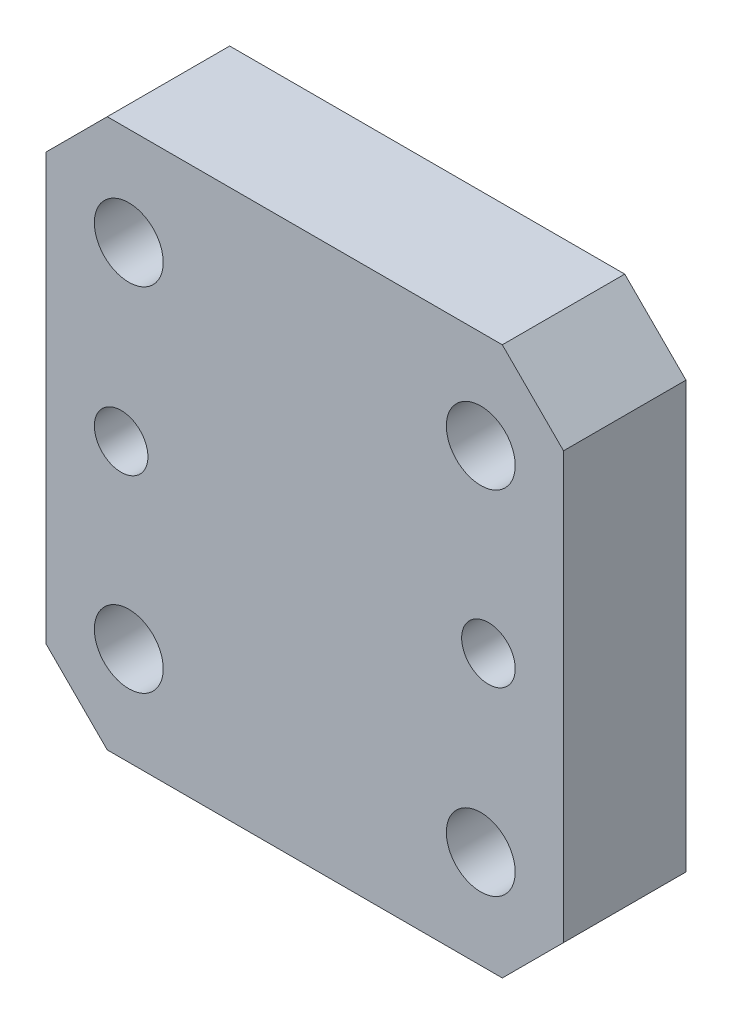
from build123d import *

# Parameters (mm, degrees)
SKETCH1_W           = 33.814565048
SKETCH1_H           = 35.83261461
BOSS_EXTRUDE1_DEPTH = 8
SKETCH2_R           = 1.75
CUT_EXTRUDE1_DEPTH  = 8
SKETCH3_R           = 2.25
CUT_EXTRUDE2_DEPTH  = 10
CHAMFER1_SIZE       = 4
CUT_EXTRUDE3_DEPTH  = 3


with BuildPart() as part:
    # Sketch1 → Boss-Extrude1 (new body)
    with BuildSketch(Plane.XY):
        Rectangle(SKETCH1_W, SKETCH1_H)
    extrude(amount=BOSS_EXTRUDE1_DEPTH)

    # Sketch2 → Cut-Extrude1 (cut)
    with BuildSketch(Plane.XY.offset(8)):
        with Locations((-12, 0)):
            Circle(SKETCH2_R)
        with Locations((12, 0)):
            Circle(SKETCH2_R)
    extrude(amount=-CUT_EXTRUDE1_DEPTH, mode=Mode.SUBTRACT)

    # Sketch3 → Cut-Extrude2 (cut)
    with BuildSketch(Plane(origin=(0, 0, 0), x_dir=(-1, 0, 0), z_dir=(0, 0, -1))):
        with Locations((11.5, -11.5)):
            Circle(SKETCH3_R)
        with Locations((-11.5, -11.5)):
            Circle(SKETCH3_R)
        with Locations((-11.5, 11.5)):
            Circle(SKETCH3_R)
        with Locations((11.5, 11.5)):
            Circle(SKETCH3_R)
    extrude(amount=-CUT_EXTRUDE2_DEPTH, mode=Mode.SUBTRACT)

    # Chamfer1
    chamfer1_edges = [part.edges().sort_by_distance(p)[0] for p in [
        (-16.907282524, 17.916307305, 4),
        (16.907282524, 17.916307305, 4),
        (16.907282524, -17.916307305, 4),
        (-16.907282524, -17.916307305, 4),
    ]]
    chamfer(chamfer1_edges, length=CHAMFER1_SIZE)

    # Sketch4 → Cut-Extrude3 (cut)
    with BuildSketch(Plane(origin=(0, 0, 0), x_dir=(-1, 0, 0), z_dir=(0, 0, -1))):
        Polygon((-12, -3.550704156), (-8.925, -1.775352078), (-8.925, 1.775352078), (-12, 3.550704156), (-15.075, 1.775352078), (-15.075, -1.775352078), align=None)
        Polygon((12, -3.550704156), (15.075, -1.775352078), (15.075, 1.775352078), (12, 3.550704156), (8.925, 1.775352078), (8.925, -1.775352078), align=None)
    extrude(amount=-CUT_EXTRUDE3_DEPTH, mode=Mode.SUBTRACT)


solid = part.part
